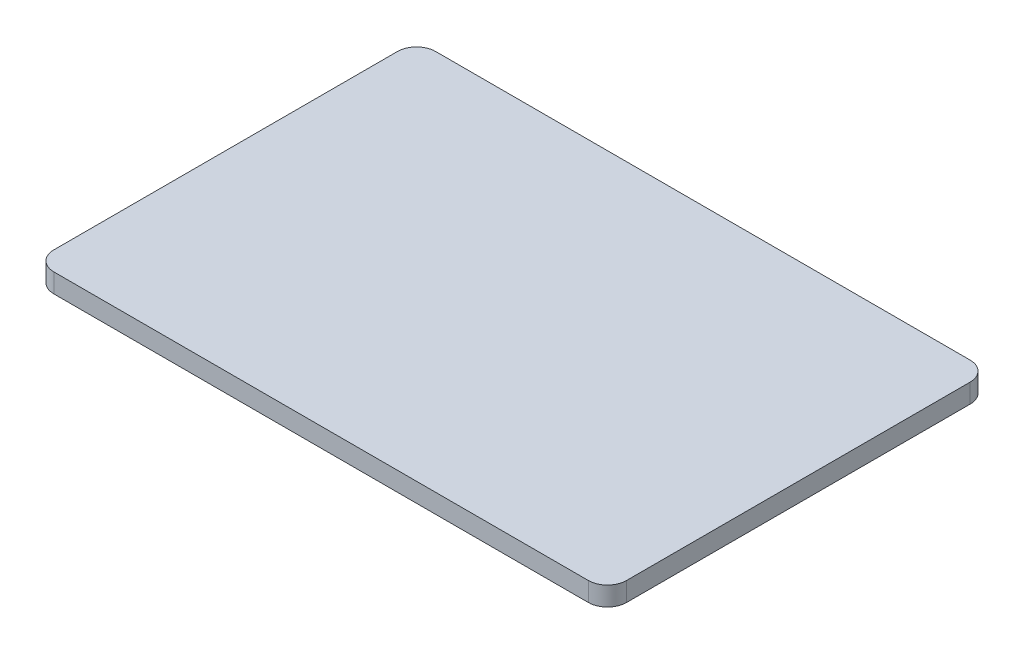
from build123d import *

# Parameters (mm, degrees)
SKETCH1_W           = 150
SKETCH1_H           = 100
BOSS_EXTRUDE1_DEPTH = 5
FILLET1_R           = 5


with BuildPart() as part:
    # Sketch1 → Boss-Extrude1 (new body)
    with BuildSketch(Plane(origin=(0, 0, 0), x_dir=(1, 0, 0), z_dir=(0, 1, 0))):
        Rectangle(SKETCH1_W, SKETCH1_H)
    extrude(amount=BOSS_EXTRUDE1_DEPTH)

    # Fillet1
    fillet1_edges = [part.edges().sort_by_distance(p)[0] for p in [
        (75, 2.5, 50),
        (-75, 2.5, 50),
        (-75, 2.5, -50),
        (75, 2.5, -50),
    ]]
    fillet(fillet1_edges, radius=FILLET1_R)


solid = part.part
